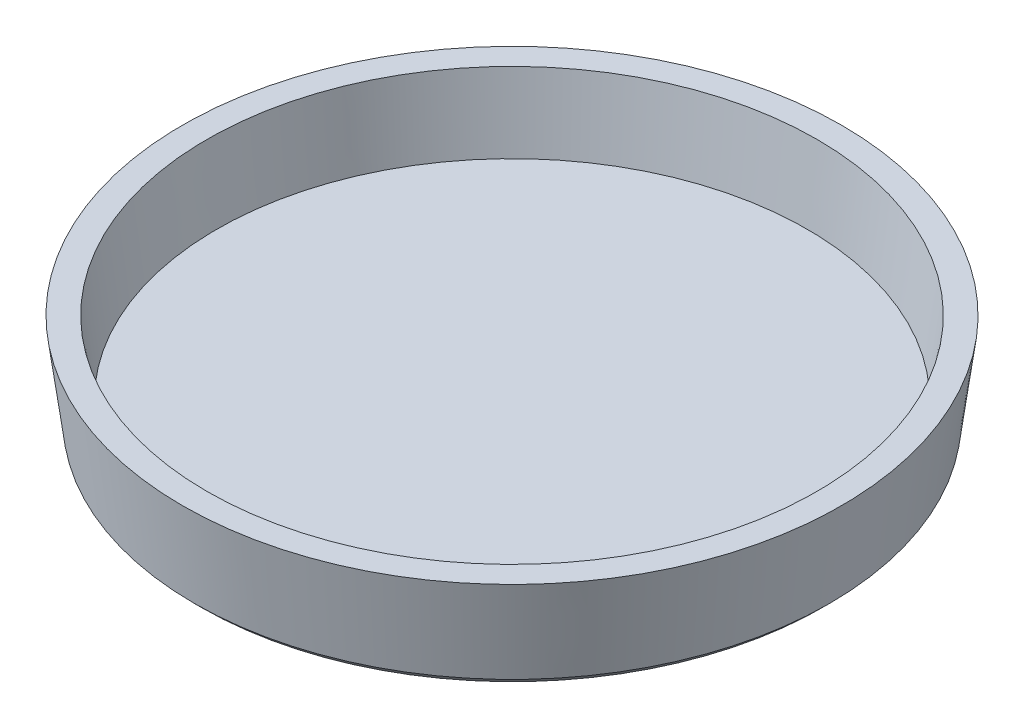
from build123d import *

# Parameters (mm, degrees)
SHELL1_T       = -3.175
CHAMFER1_SIZE  = 0.762
CHAMFER1_SIZE2 = 0.885503909


with BuildPart() as part:
    # Sketch1 → Revolve1 (revolve)
    with BuildSketch(Plane(origin=(0, 0, 0), x_dir=(0, 0, -1), z_dir=(1, 0, 0)), mode=Mode.PRIVATE) as revolve1_sk:
        Polygon((0, 0), (41.275, 0), (42.9514969, 12.7), (0, 12.7), align=None)
    revolve(revolve1_sk.sketch.rotate(Axis((0, 0, 0), (0, -1, 0)), 180), axis=Axis((0, 0, 0), (0, -1, 0)))

    # Shell1
    shell1_openings = [part.faces().sort_by_distance(p)[0] for p in [
        (0, 12.7, 0),
    ]]
    offset(amount=SHELL1_T, openings=shell1_openings, kind=Kind.INTERSECTION)

    # Chamfer1
    chamfer1_edges = [part.edges().sort_by_distance(p)[0] for p in [
        (0, 0, -41.275),
    ]]
    chamfer1_side = [part.faces().sort_by_distance(p)[0] for p in [
        (0, 0, 0),
    ]]
    chamfer(chamfer1_edges, length=CHAMFER1_SIZE, length2=CHAMFER1_SIZE2, reference=chamfer1_side[0])


solid = part.part
